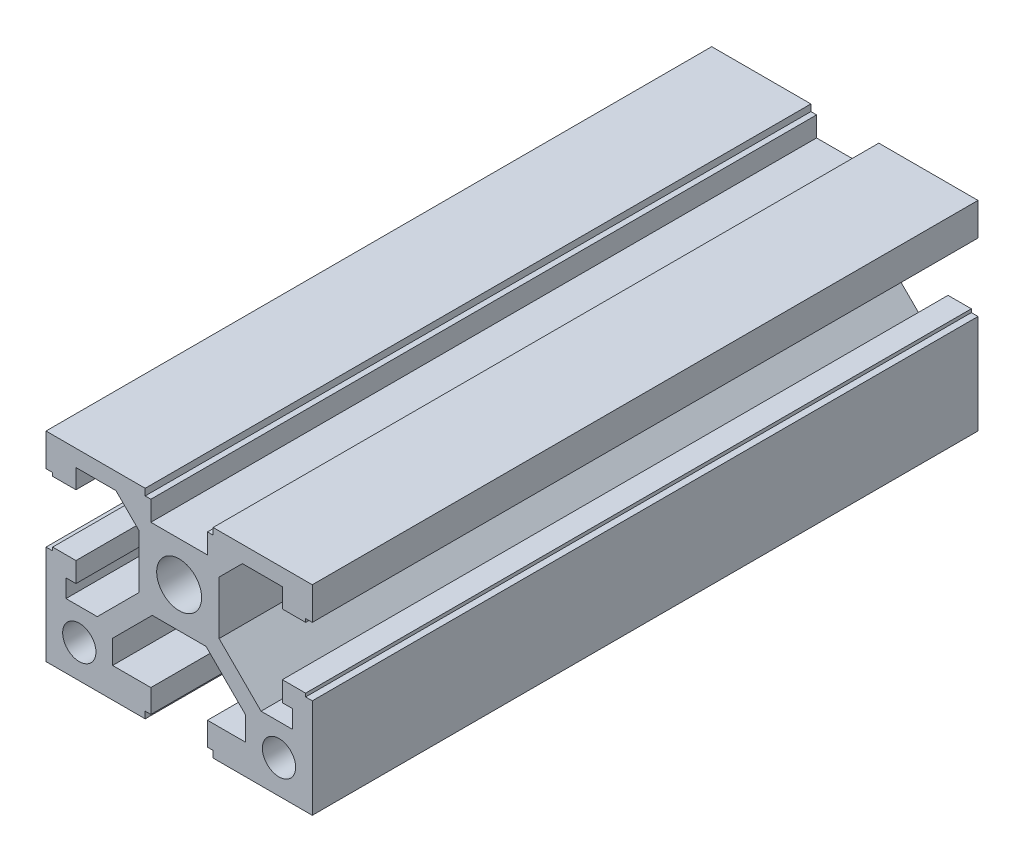
from build123d import *

# Parameters (mm, degrees)
SKETCH_1_R      = 3.375
SKETCH_1_R_2    = 2.5
EXTRUDE_1_DEPTH = 100


with BuildPart() as part:
    # 草图1 → 凸台-拉伸1 (new body)
    with BuildSketch(Plane.XY):
        Polygon((0, 0), (14.9, 0), (14.9, 1), (15.75, 1), (15.75, 4.5), (10, 4.5), (10, 8.040202025), (15.959797975, 14), (24.040202025, 14), (30, 8.040202025), (30, 4.5), (24.25, 4.5), (24.25, 1), (25.1, 1), (25.1, 0), (40, 0), (40, 14.9), (39, 14.9), (39, 15.4), (35.5, 15.4), (35.5, 12.4), (37, 12.4), (37, 9.7), (32.3, 9.7), (26, 16), (26, 24), (29.5, 27.5), (35.5, 27.5), (35.5, 24.6), (39, 24.6), (39, 25.1), (40, 25.1), (40, 30), (25.1, 30), (25.1, 29), (24.25, 29), (24.25, 26), (15.75, 26), (15.75, 29), (14.9, 29), (14.9, 30), (0, 30), (0, 25.1), (1, 25.1), (1, 24.6), (4.5, 24.6), (4.5, 27.5), (10.5, 27.5), (14, 24), (14, 16), (7.7, 9.7), (3, 9.7), (3, 12.4), (4.5, 12.4), (4.5, 15.4), (1, 15.4), (1, 14.9), (0, 14.9), align=None)
        with Locations((20, 20)):
            Circle(SKETCH_1_R, mode=Mode.SUBTRACT)
        with Locations((35, 5)):
            Circle(SKETCH_1_R_2, mode=Mode.SUBTRACT)
        with Locations((5, 5)):
            Circle(SKETCH_1_R_2, mode=Mode.SUBTRACT)
    extrude(amount=EXTRUDE_1_DEPTH)


solid = part.part
